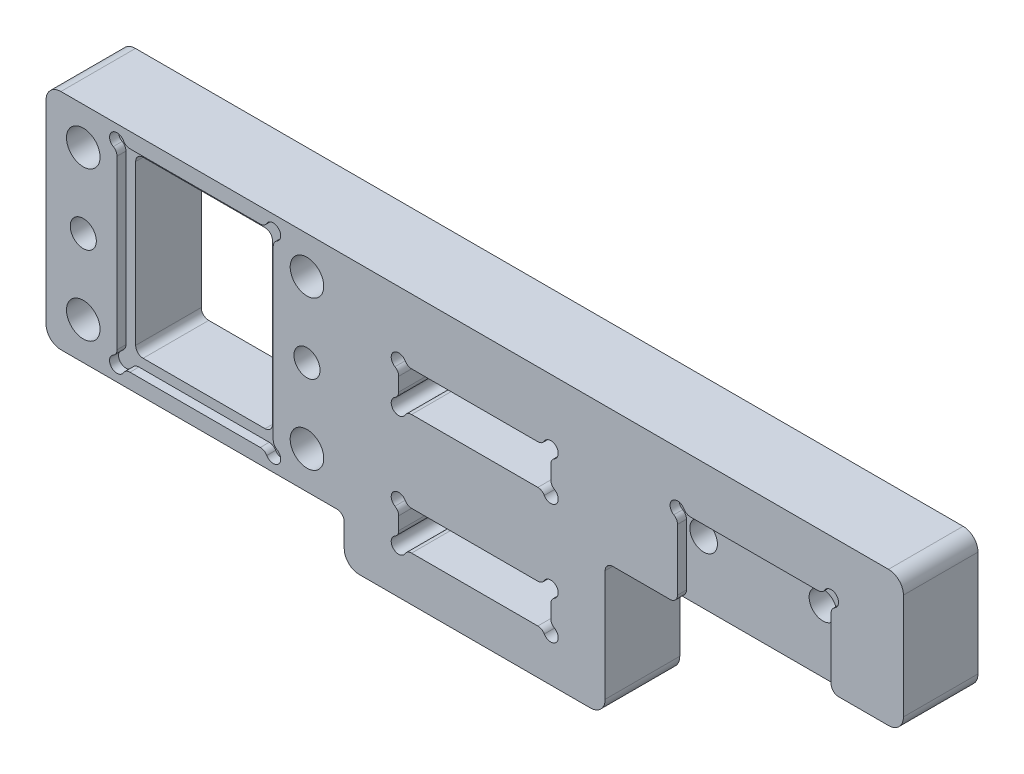
from build123d import *

# Parameters (mm, degrees)
SKICA1_R                      = 2.25
SKICA1_R_2                    = 1.75
SKICA1_W                      = 20.4
SKICA1_H                      = 5.2
SKICA1_H_2                    = 5.3
P_IDAT_VYSUNUT_M1_DEPTH       = 10
SKICA2_W                      = 20.6
SKICA2_H                      = 10.95
ODEBRAT_VYSUNUT_M1_DEPTH      = 1.2
SKICA4_R                      = 1.85
ODEBRAT_VYSUNUT_M2_DEPTH      = 69.460937767
ODEBRAT_VYSUNUT_M3_DEPTH      = 69.625505463
ODEBRAT_VYSUNUT_M3_DEPTH_BACK = 69.625505463
SKICA5_W                      = 18.35
SKICA5_H                      = 23.35
SKICA5_3_W                    = 20.95
SKICA5_3_H                    = 25.95
ODEBRAT_VYSUNUT_M4_DEPTH      = 1.2
SKICA6_R                      = 1
ODEBRAT_VYSUNUT_M5_DEPTH      = 1.2
SKICA7_R                      = 1
ODEBRAT_VYSUNUT_M6_DEPTH      = 69.625505463
ZAOBLIT3_R                    = 2
ZAOBLIT4_R                    = 1
ZAOBLIT5_R                    = 1
ZAOBLIT6_R                    = 1


with BuildPart() as part:
    # Skica1 → Přidat vysunutím1 (new body)
    with BuildSketch(Plane.XY):
        Polygon((-57.5, 36.1), (57.5, 36.1), (57.5, 17.95), (17.5, 17.95), (17.5, 0), (-17.5, 0), (-17.5, 6.1), (-57.5, 6.1), align=None)
        with Locations((-52.5, 31.1)):
            Circle(SKICA1_R, mode=Mode.SUBTRACT)
        with Locations((-22.5, 31.1)):
            Circle(SKICA1_R, mode=Mode.SUBTRACT)
        with Locations((-52.5, 11.1)):
            Circle(SKICA1_R, mode=Mode.SUBTRACT)
        with Locations((-22.5, 11.1)):
            Circle(SKICA1_R, mode=Mode.SUBTRACT)
        with Locations((-52.5, 21.1)):
            Circle(SKICA1_R_2, mode=Mode.SUBTRACT)
        with Locations((-22.5, 21.1)):
            Circle(SKICA1_R_2, mode=Mode.SUBTRACT)
        with Locations((0, 8.6)):
            Rectangle(SKICA1_W, SKICA1_H, mode=Mode.SUBTRACT)
        with Locations((0, 24.75)):
            Rectangle(SKICA1_W, SKICA1_H_2, mode=Mode.SUBTRACT)
    extrude(amount=-P_IDAT_VYSUNUT_M1_DEPTH)

    # Skica2 → Odebrat vysunutím1 (cut)
    with BuildSketch(Plane.XY):
        with Locations((37.5, 23.425)):
            Rectangle(SKICA2_W, SKICA2_H)
    extrude(amount=-ODEBRAT_VYSUNUT_M1_DEPTH, mode=Mode.SUBTRACT)

    # Skica4 → Odebrat vysunutím2 (cut, through all)
    with BuildSketch(Plane.XY.offset(-1.2)):
        with Locations((45.5, 26.35)):
            Circle(SKICA4_R)
        with Locations((29.5, 26.35)):
            Circle(SKICA4_R)
    extrude(amount=-ODEBRAT_VYSUNUT_M2_DEPTH, mode=Mode.SUBTRACT)

    # Skica5 → Odebrat vysunutím3 (cut, two sides: drawn at the far end of the back side and taken through both)
    with BuildSketch(Plane.XY.offset(-ODEBRAT_VYSUNUT_M3_DEPTH_BACK)):
        with Locations((-37.5, 21.1)):
            Rectangle(SKICA5_W, SKICA5_H)
    extrude(amount=ODEBRAT_VYSUNUT_M3_DEPTH + ODEBRAT_VYSUNUT_M3_DEPTH_BACK, mode=Mode.SUBTRACT)

    # Skica5<3> → Odebrat vysunutím4 (cut)
    with BuildSketch(Plane.XY):
        with Locations((-37.5, 21.1)):
            Rectangle(SKICA5_3_W, SKICA5_3_H)
    extrude(amount=-ODEBRAT_VYSUNUT_M4_DEPTH, mode=Mode.SUBTRACT)

    # Skica6 → Odebrat vysunutím5 (cut)
    with BuildSketch(Plane.XY):
        with Locations((-47.975, 34.075)):
            Circle(SKICA6_R)
        with Locations((-27.025, 34.075)):
            Circle(SKICA6_R)
        with Locations((-47.975, 8.125)):
            Circle(SKICA6_R)
        with Locations((-27.025, 8.125)):
            Circle(SKICA6_R)
        with Locations((27.2, 28.9)):
            Circle(SKICA6_R)
        with Locations((47.8, 28.9)):
            Circle(SKICA6_R)
    extrude(amount=-ODEBRAT_VYSUNUT_M5_DEPTH, mode=Mode.SUBTRACT)

    # Skica7 → Odebrat vysunutím6 (cut, through all)
    with BuildSketch(Plane.XY):
        with Locations((-10.2, 27.4)):
            Circle(SKICA7_R)
        with Locations((-10.2, 22.1)):
            Circle(SKICA7_R)
        with Locations((10.2, 22.1)):
            Circle(SKICA7_R)
        with Locations((10.2, 27.4)):
            Circle(SKICA7_R)
        with Locations((-10.2, 11.2)):
            Circle(SKICA7_R)
        with Locations((-10.2, 6)):
            Circle(SKICA7_R)
        with Locations((10.2, 6)):
            Circle(SKICA7_R)
        with Locations((10.2, 11.2)):
            Circle(SKICA7_R)
    extrude(amount=-ODEBRAT_VYSUNUT_M6_DEPTH, mode=Mode.SUBTRACT)

    # Zaoblit3
    zaoblit3_edges = [part.edges().sort_by_distance(p)[0] for p in [
        (17.5, 0, -5),
        (-17.5, 0, -5),
        (-57.5, 6.1, -5),
        (-57.5, 36.1, -5),
        (57.5, 36.1, -5),
        (57.5, 17.95, -5),
    ]]
    fillet(zaoblit3_edges, radius=ZAOBLIT3_R)

    # Zaoblit4
    zaoblit4_edges = [part.edges().sort_by_distance(p)[0] for p in [
        (-17.5, 6.1, -5),
        (17.5, 17.95, -5),
    ]]
    fillet(zaoblit4_edges, radius=ZAOBLIT4_R)

    # Zaoblit5
    zaoblit5_edges = [part.edges().sort_by_distance(p)[0] for p in [
        (-46.675, 32.775, -5.6),
        (-28.325, 32.775, -5.6),
        (-28.325, 9.425, -5.6),
        (-46.675, 9.425, -5.6),
        (46.8, 28.9, -0.6),
        (47.8, 27.9, -0.6),
        (-28.025, 34.075, -0.6),
        (-27.025, 33.075, -0.6),
        (-47.975, 9.125, -0.6),
        (-46.975, 8.125, -0.6),
        (-27.025, 9.125, -0.6),
        (-28.025, 8.125, -0.6),
        (27.2, 27.9, -0.6),
        (28.2, 28.9, -0.6),
        (-47.975, 33.075, -0.6),
        (-46.975, 34.075, -0.6),
        (27.2, 17.95, -0.6),
        (47.8, 17.95, -0.6),
    ]]
    fillet(zaoblit5_edges, radius=ZAOBLIT5_R)

    # Zaoblit6
    zaoblit6_edges = [part.edges().sort_by_distance(p)[0] for p in [
        (10.2, 23.1, -5),
        (10.2, 26.4, -5),
        (10.2, 10.2, -5),
        (10.2, 7, -5),
        (-9.2, 6, -5),
        (-10.2, 10.2, -5),
        (-9.2, 22.1, -5),
        (-10.2, 26.4, -5),
        (-9.2, 11.2, -5),
        (9.2, 27.4, -5),
        (9.2, 22.1, -5),
        (-10.2, 23.1, -5),
        (-10.2, 7, -5),
        (9.2, 6, -5),
        (9.2, 11.2, -5),
        (-9.2, 27.4, -5),
    ]]
    fillet(zaoblit6_edges, radius=ZAOBLIT6_R)


solid = part.part
